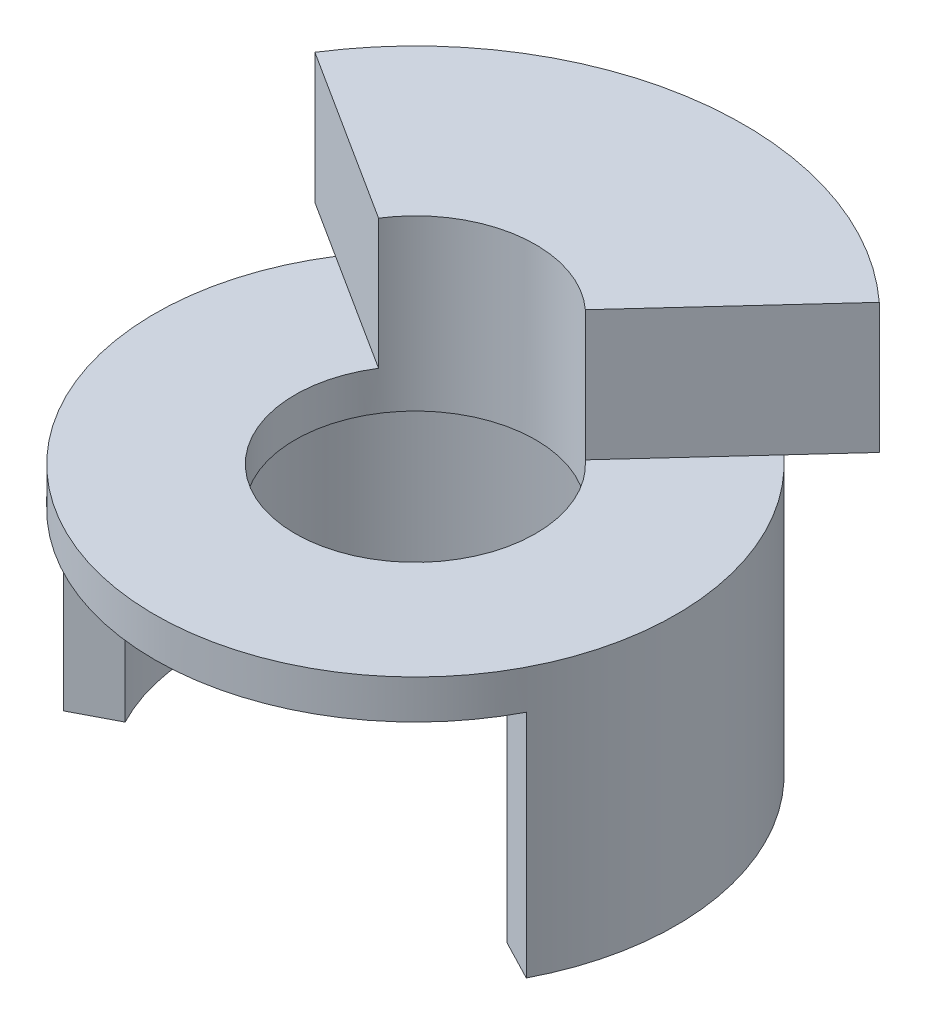
from build123d import *

# Parameters (mm, degrees)
SKETCH1_R           = 5.0927
BOSS_EXTRUDE1_DEPTH = 5.2578
SKETCH2_R           = 2.3495
CUT_EXTRUDE1_DEPTH  = 9.917154671
SKETCH3_R           = 4.2037
CUT_EXTRUDE2_DEPTH  = 4.4958
CUT_EXTRUDE3_DEPTH  = 4.4958
BOSS_EXTRUDE2_START = 2.54
BOSS_EXTRUDE2_DEPTH = 2.54


with BuildPart() as part:
    # Sketch1 → Boss-Extrude1 (new body)
    with BuildSketch(Plane(origin=(0, 0, 0), x_dir=(1, 0, 0), z_dir=(0, 1, 0))):
        with Locations(Location((0, 0, 0), (0, 0, 270))):
            Circle(SKETCH1_R)
    extrude(amount=BOSS_EXTRUDE1_DEPTH)

    # Sketch2 → Cut-Extrude1 (cut, through all)
    with BuildSketch(Plane(origin=(0, 5.2578, 0), x_dir=(1, 0, 0), z_dir=(0, 1, 0))):
        with Locations(Location((0, 0, 0), (0, 0, 270))):
            Circle(SKETCH2_R)
    extrude(amount=-CUT_EXTRUDE1_DEPTH, mode=Mode.SUBTRACT)

    # Sketch3 → Cut-Extrude2 (cut)
    with BuildSketch(Plane.XZ):
        with Locations(Location((0, 0, 0), (0, 0, 270))):
            Circle(SKETCH3_R)
    extrude(amount=-CUT_EXTRUDE2_DEPTH, mode=Mode.SUBTRACT)

    # Sketch5 → Cut-Extrude3 (cut)
    with BuildSketch(Plane.XZ):
        with BuildLine():
            Line((0, 0), (4.51728007, 2.351547163))
            ThreePointArc((4.51728007, 2.351547163), (0, 5.0927), (-4.51728007, 2.351547163))
            Line((-4.51728007, 2.351547163), (0, 0))
        make_face()
    extrude(amount=-CUT_EXTRUDE3_DEPTH, mode=Mode.SUBTRACT)

    # Sketch4 → Boss-Extrude2 (add)
    with BuildSketch(Plane(origin=(0, 5.2578, 0), x_dir=(1, 0, 0), z_dir=(0, 1, 0)).offset(BOSS_EXTRUDE2_START)):
        with BuildLine():
            Line((4.332897797, 4.7285282), (1.587299193, 1.732233103))
            ThreePointArc((1.587299193, 1.732233103), (-0.306671289, 2.329399702), (-1.981548202, 1.26238543))
            Line((-1.981548202, 1.26238543), (-5.409091038, 3.445971038))
            ThreePointArc((-5.409091038, 3.445971038), (-0.837129734, 6.358631618), (4.332897797, 4.7285282))
        make_face()
    extrude(amount=-BOSS_EXTRUDE2_DEPTH)


solid = part.part
